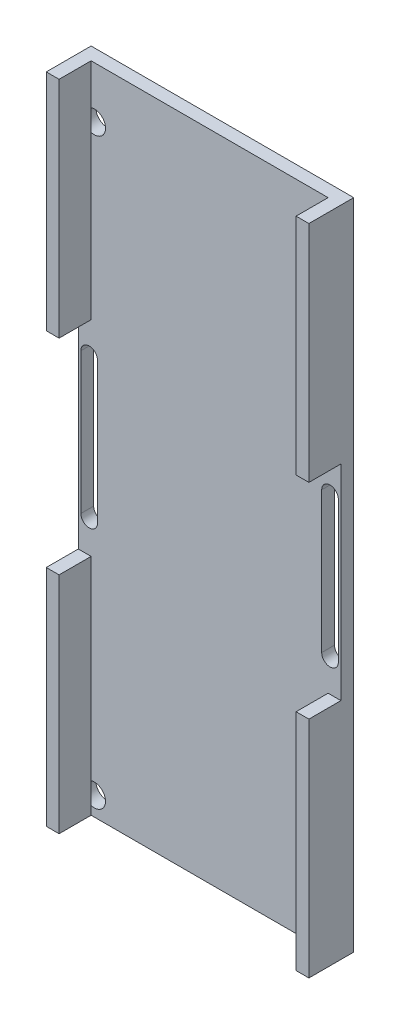
from build123d import *

# Parameters (mm, degrees)
FLOOR_AND_STRAP_GUIDES_PROFILE_W = 41
FLOOR_AND_STRAP_GUIDES_PROFILE_H = 102
FLOOR_AND_STRAP_GUIDES_PROFILE_R = 1.75
FLOOR_AND_STRAP_GUIDES_DEPTH     = 2
INTEGRAL_START                   = 2
INTEGRAL_EDGE_STOPS_PROFILE_W    = 2
INTEGRAL_EDGE_STOPS_PROFILE_H    = 35
INTEGRAL_EDGE_STOPS_DEPTH        = 5


with BuildPart() as part:
    # Floor and strap guides profile → Floor and strap guides (new body)
    with BuildSketch(Plane.XY):
        Rectangle(FLOOR_AND_STRAP_GUIDES_PROFILE_W, FLOOR_AND_STRAP_GUIDES_PROFILE_H)
        with Locations((-18, -48)):
            Circle(FLOOR_AND_STRAP_GUIDES_PROFILE_R, mode=Mode.SUBTRACT)
        with Locations((-18, 43)):
            Circle(FLOOR_AND_STRAP_GUIDES_PROFILE_R, mode=Mode.SUBTRACT)
        with Locations((18, -48)):
            Circle(FLOOR_AND_STRAP_GUIDES_PROFILE_R, mode=Mode.SUBTRACT)
        with Locations((18, 43)):
            Circle(FLOOR_AND_STRAP_GUIDES_PROFILE_R, mode=Mode.SUBTRACT)
        with BuildLine():
            Line((-17.5, -11), (-17.5, 11))
            ThreePointArc((-17.5, 11), (-18.8, 12.3), (-20.1, 11))
            Line((-20.1, 11), (-20.1, -11))
            ThreePointArc((-20.1, -11), (-18.8, -12.3), (-17.5, -11))
        make_face(mode=Mode.SUBTRACT)
        with BuildLine():
            Line((20.1, -11), (20.1, 11))
            ThreePointArc((20.1, 11), (18.8, 12.3), (17.5, 11))
            Line((17.5, 11), (17.5, -11))
            ThreePointArc((17.5, -11), (18.8, -12.3), (20.1, -11))
        make_face(mode=Mode.SUBTRACT)
    extrude(amount=FLOOR_AND_STRAP_GUIDES_DEPTH)

    # Integral edge stops profile → Integral edge stops (add)
    with BuildSketch(Plane.XY.offset(INTEGRAL_START)):
        with Locations((-19.5, -33.5)):
            Rectangle(INTEGRAL_EDGE_STOPS_PROFILE_W, INTEGRAL_EDGE_STOPS_PROFILE_H)
        with Locations((19.5, -33.5)):
            Rectangle(INTEGRAL_EDGE_STOPS_PROFILE_W, INTEGRAL_EDGE_STOPS_PROFILE_H)
        with Locations((-19.5, 33.5)):
            Rectangle(INTEGRAL_EDGE_STOPS_PROFILE_W, INTEGRAL_EDGE_STOPS_PROFILE_H)
        with Locations((19.5, 33.5)):
            Rectangle(INTEGRAL_EDGE_STOPS_PROFILE_W, INTEGRAL_EDGE_STOPS_PROFILE_H)
    extrude(amount=INTEGRAL_EDGE_STOPS_DEPTH)


solid = part.part
